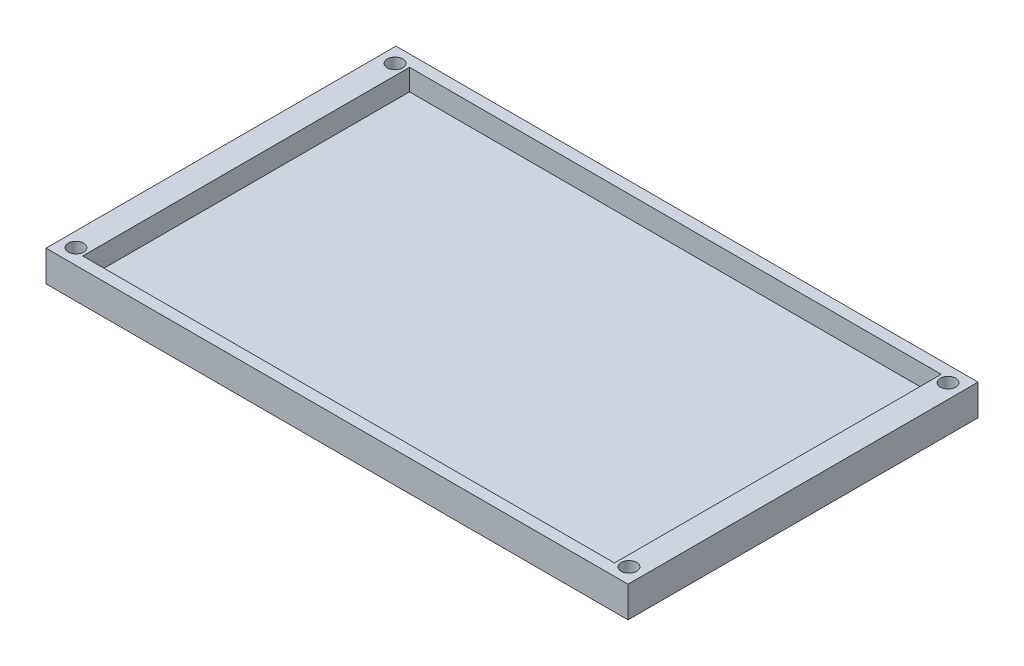
from build123d import *

# Parameters (mm, degrees)
SKETCH1_W           = 150.5
SKETCH1_H           = 90.5
SKETCH1_W_2         = 137.5
SKETCH1_H_2         = 84.5
BOSS_EXTRUDE1_DEPTH = 8
SKETCH2_R           = 2
CUT_EXTRUDE1_DEPTH  = 39
SKETCH3_W           = 84.5
SKETCH3_H           = 2.5
BOSS_EXTRUDE2_DEPTH = 138


with BuildPart() as part:
    # Sketch1 → Boss-Extrude1 (new body)
    with BuildSketch(Plane(origin=(0, 0, 0), x_dir=(1, 0, 0), z_dir=(0, 1, 0))):
        Rectangle(SKETCH1_W, SKETCH1_H)
        Rectangle(SKETCH1_W_2, SKETCH1_H_2, mode=Mode.SUBTRACT)
    extrude(amount=BOSS_EXTRUDE1_DEPTH)

    # Sketch2 → Cut-Extrude1 (cut)
    with BuildSketch(Plane(origin=(0, 8, 0), x_dir=(1, 0, 0), z_dir=(0, 1, 0))):
        with Locations(Location((-71.5, 41.25, 0), (0, 0, 270))):
            Circle(SKETCH2_R)
        with Locations(Location((-71.5, -41.25, 0), (0, 0, 270))):
            Circle(SKETCH2_R)
        with Locations(Location((71.5, -41.25, 0), (0, 0, 270))):
            Circle(SKETCH2_R)
        with Locations(Location((71.5, 41.25, 0), (0, 0, 270))):
            Circle(SKETCH2_R)
    extrude(amount=-CUT_EXTRUDE1_DEPTH, mode=Mode.SUBTRACT)

    # Sketch3 → Boss-Extrude2 (add)
    with BuildSketch(Plane(origin=(-68.75, 0, 0), x_dir=(0, 0, -1), z_dir=(1, 0, 0))):
        with Locations((0, 1.25)):
            Rectangle(SKETCH3_W, SKETCH3_H)
    extrude(amount=BOSS_EXTRUDE2_DEPTH)


solid = part.part
